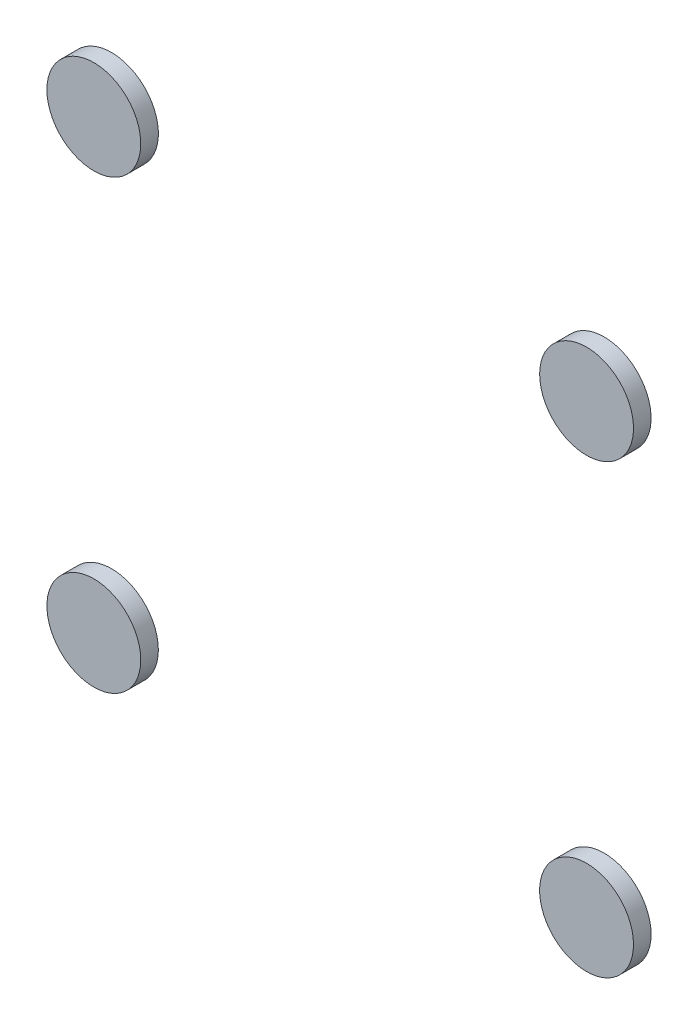
from build123d import *

# Parameters (mm, degrees)
SKETCH_2_R        = 4
EXTRUDE_1_DEPTH   = 1.5
EXTRUDE_1_2_DEPTH = 1.5
EXTRUDE_1_3_DEPTH = 1.5
EXTRUDE_1_4_DEPTH = 1.5


with BuildPart() as part:
    # 草图2 → 凸台-拉伸1 (new body)
    with BuildSketch(Plane.XY):
        with Locations((11, -19.052558883)):
            Circle(SKETCH_2_R)
    extrude(amount=EXTRUDE_1_DEPTH)


with BuildPart() as body_2:
    # 草图2 → Extrude 1 2 (new body)
    with BuildSketch(Plane.XY):
        with Locations((-31, -19.052558883)):
            Circle(SKETCH_2_R)
    extrude(amount=EXTRUDE_1_2_DEPTH)


with BuildPart() as body_3:
    # 草图2 → Extrude 1 3 (new body)
    with BuildSketch(Plane.XY):
        with Locations(Location((-31, 19.052558883, 0), (0, 0, 180))):
            Circle(SKETCH_2_R)
    extrude(amount=EXTRUDE_1_3_DEPTH)


with BuildPart() as body_4:
    # 草图2 → Extrude 1 4 (new body)
    with BuildSketch(Plane.XY):
        with Locations(Location((11, 19.052558883, 0), (0, 0, 180))):
            Circle(SKETCH_2_R)
    extrude(amount=EXTRUDE_1_4_DEPTH)


solid = Compound([part.part, body_2.part, body_3.part, body_4.part])
